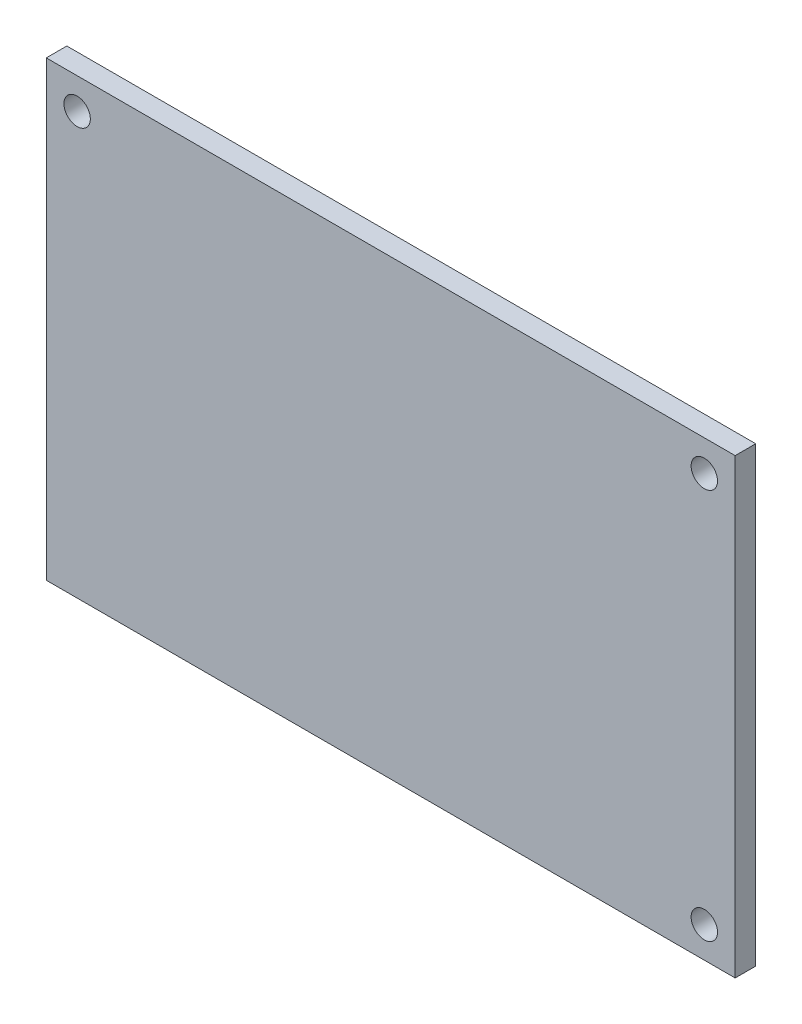
from build123d import *

# Parameters (mm, degrees)
SKETCH1_W                 = 85.09
SKETCH1_H                 = 55.88
BOSS_EXTRUDE1_DEPTH       = 2.54
F_4_CLEARANCE_HOLE1_D     = 3.2639
F_4_CLEARANCE_HOLE1_DEPTH = 9.652
F_4_CLEARANCE_HOLE1_TIP   = 0.980574487


with BuildPart() as part:
    # Sketch1 → Boss-Extrude1 (new body)
    with BuildSketch(Plane.XY):
        Rectangle(SKETCH1_W, SKETCH1_H)
    extrude(amount=BOSS_EXTRUDE1_DEPTH)

    # #4 Clearance Hole1
    with Locations(Plane.XY.offset(2.54)):
        with Locations((-38.735, 24.13), (38.735, -24.13), (38.735, 24.13)):
            Hole(F_4_CLEARANCE_HOLE1_D / 2, depth=F_4_CLEARANCE_HOLE1_DEPTH)
            with Locations((0, 0, -(F_4_CLEARANCE_HOLE1_DEPTH + F_4_CLEARANCE_HOLE1_TIP / 2))):  # 118° drill point
                Cone(0, F_4_CLEARANCE_HOLE1_D / 2, F_4_CLEARANCE_HOLE1_TIP, mode=Mode.SUBTRACT)


solid = part.part
